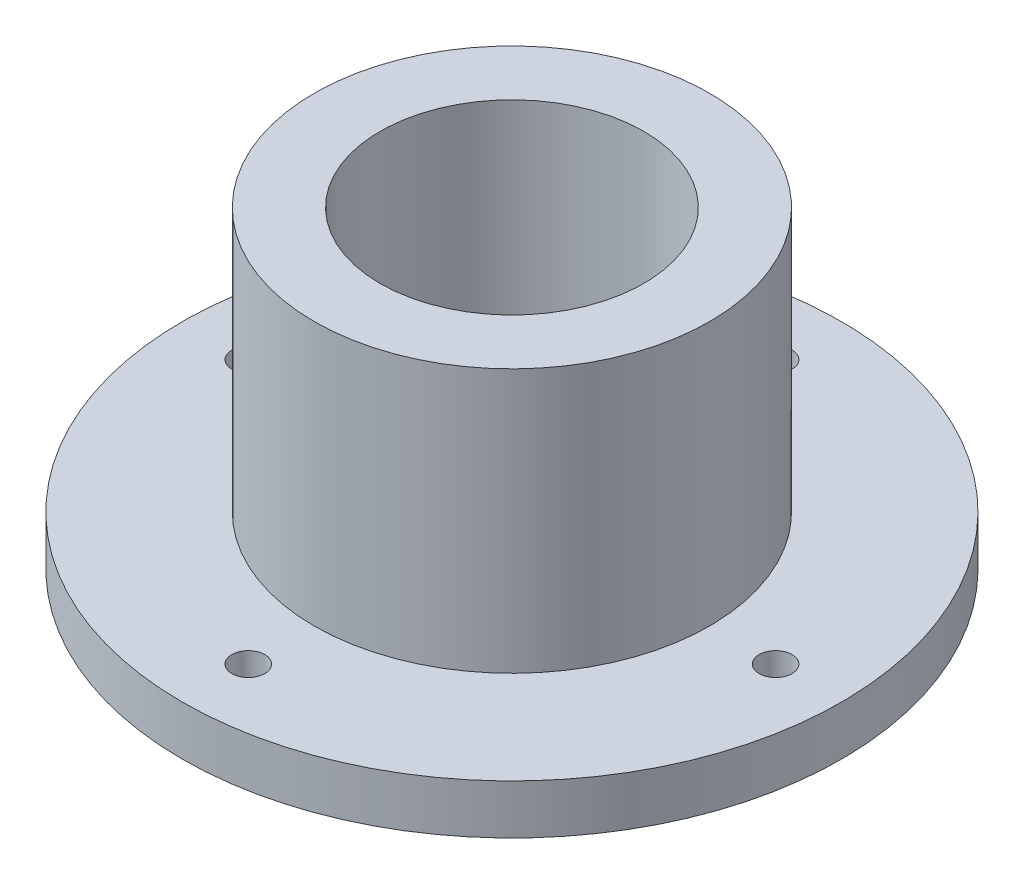
from build123d import *

# Parameters (mm, degrees)
SKETCH2_R               = 63.5
BOSS_EXTRUDE1_DEPTH     = 9.525
SKETCH2_3_R             = 38.1
BOSS_EXTRUDE2_DEPTH     = 50.8
CUT_EXTRUDE1_DEPTH      = 50.8
CUT_EXTRUDE1_DEPTH_BACK = 50.8
SKETCH2_4_R             = 25.4
SKETCH3_R               = 3.175
CUT_EXTRUDE2_DEPTH      = 50.8


with BuildPart() as part:
    # Sketch2 → Boss-Extrude1 (new body)
    with BuildSketch(Plane(origin=(0, 0, 0), x_dir=(1, 0, 0), z_dir=(0, 1, 0))):
        Circle(SKETCH2_R)
    extrude(amount=-BOSS_EXTRUDE1_DEPTH)

    # Sketch2<3> → Boss-Extrude2 (add)
    with BuildSketch(Plane(origin=(0, 0, 0), x_dir=(1, 0, 0), z_dir=(0, 1, 0))):
        Circle(SKETCH2_3_R)
    extrude(amount=BOSS_EXTRUDE2_DEPTH)

    # Sketch2<4> → Cut-Extrude1 (cut, two sides: drawn at the far end of the back side and taken through both)
    with BuildSketch(Plane(origin=(0, 0, 0), x_dir=(1, 0, 0), z_dir=(0, 1, 0)).offset(-CUT_EXTRUDE1_DEPTH_BACK)):
        Circle(SKETCH2_4_R)
    extrude(amount=CUT_EXTRUDE1_DEPTH + CUT_EXTRUDE1_DEPTH_BACK, mode=Mode.SUBTRACT)

    # Sketch3 → Cut-Extrude2 (cut)
    with BuildSketch(Plane(origin=(0, -9.525, 0), x_dir=(-1, 0, 0), z_dir=(0, -1, 0))):
        with Locations((0, -50.8)):
            Circle(SKETCH3_R)
        with Locations((-50.8, 0)):
            Circle(SKETCH3_R)
        with Locations((0, 50.8)):
            Circle(SKETCH3_R)
        with Locations((50.8, 0)):
            Circle(SKETCH3_R)
    extrude(amount=-CUT_EXTRUDE2_DEPTH, mode=Mode.SUBTRACT)


solid = part.part
